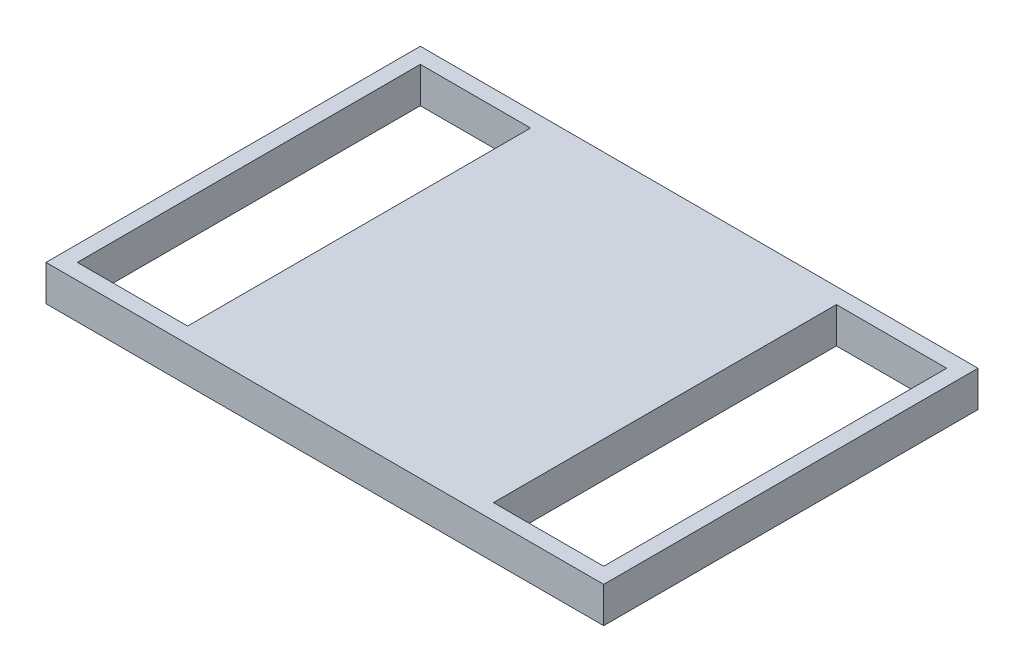
from build123d import *

# Parameters (mm, degrees)
SKETCH5_W           = 395.4
SKETCH5_H           = 265.4
BOSS_EXTRUDE3_DEPTH = 25.4
SKETCH6_W           = 78.175
SKETCH6_H           = 243.175
SKETCH6_W_2         = 75
SKETCH6_H_2         = 240
CUT_EXTRUDE1_DEPTH  = 240.4571778


with BuildPart() as part:
    # Sketch5 → Boss-Extrude3 (new body)
    with BuildSketch(Plane(origin=(0, 0, 0), x_dir=(1, 0, 0), z_dir=(0, 1, 0))):
        Rectangle(SKETCH5_W, SKETCH5_H)
    extrude(amount=BOSS_EXTRUDE3_DEPTH)

    # Sketch6 → Cut-Extrude1 (cut, through all)
    # profile 1 of 4: a face of its own
    with BuildSketch(Plane(origin=(0, 25.4, 0), x_dir=(1, 0, 0), z_dir=(0, 1, 0))):
        with Locations((147.5, 0)):
            Rectangle(SKETCH6_W, SKETCH6_H)
        with Locations((147.5, 0)):
            Rectangle(SKETCH6_W_2, SKETCH6_H_2, mode=Mode.SUBTRACT)
    # profile 2 of 4: a face of its own
    with BuildSketch(Plane(origin=(0, 25.4, 0), x_dir=(1, 0, 0), z_dir=(0, 1, 0))):
        with Locations((147.5, 0)):
            Rectangle(SKETCH6_W_2, SKETCH6_H_2)
    # profile 3 of 4: a face of its own
    with BuildSketch(Plane(origin=(0, 25.4, 0), x_dir=(1, 0, 0), z_dir=(0, 1, 0))):
        with Locations((-147.5, 0)):
            Rectangle(SKETCH6_W, SKETCH6_H)
        with Locations((-147.5, 0)):
            Rectangle(SKETCH6_W_2, SKETCH6_H_2, mode=Mode.SUBTRACT)
    # profile 4 of 4: a face of its own
    with BuildSketch(Plane(origin=(0, 25.4, 0), x_dir=(1, 0, 0), z_dir=(0, 1, 0))):
        with Locations((-147.5, 0)):
            Rectangle(SKETCH6_W_2, SKETCH6_H_2)
    extrude(amount=-CUT_EXTRUDE1_DEPTH, mode=Mode.SUBTRACT)


solid = part.part
